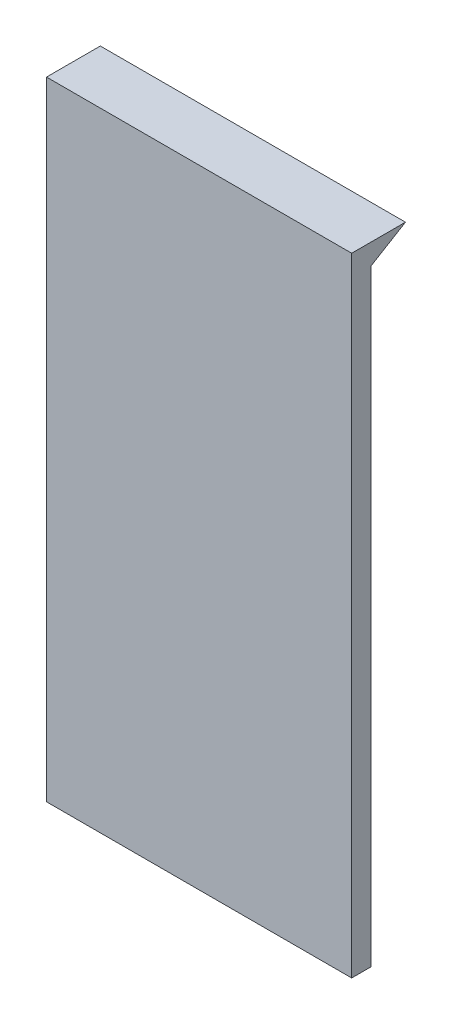
from build123d import *

# Parameters (mm, degrees)
ESQUISSE1_W        = 47
ESQUISSE1_H        = 93.5
BOSS_EXTRU_1_DEPTH = 3
BOSS_EXTRU_2_DEPTH = 47


with BuildPart() as part:
    # Esquisse1 → Boss.-Extru.1 (new body)
    with BuildSketch(Plane.XY):
        with Locations((23.5, 46.75)):
            Rectangle(ESQUISSE1_W, ESQUISSE1_H)
    extrude(amount=-BOSS_EXTRU_1_DEPTH)

    # Esquisse2 → Boss.-Extru.2 (add)
    with BuildSketch(Plane(origin=(47, 0, 0), x_dir=(0, 0, -1), z_dir=(1, 0, 0))):
        Polygon((3, 93.5), (8.284087356, 96.675), (0, 96.675), (0, 93.5), align=None)
    extrude(amount=-BOSS_EXTRU_2_DEPTH)


solid = part.part
